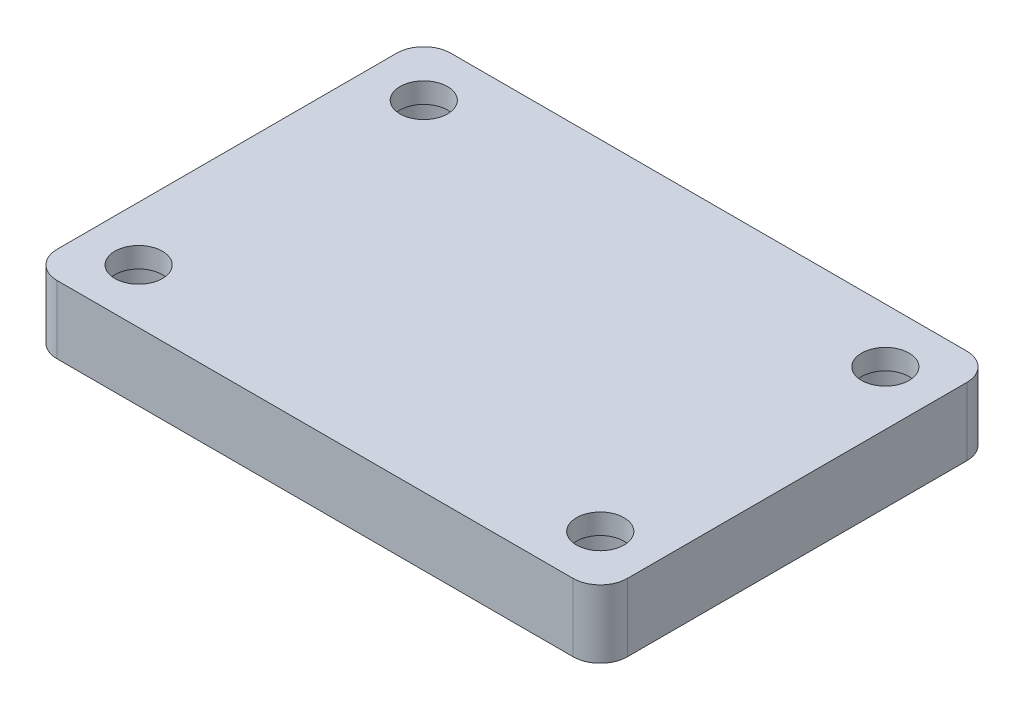
from build123d import *

# Parameters (mm, degrees)
SKETCH1_W                                     = 84
SKETCH1_H                                     = 58
EXTRUDE1_DEPTH                                = 10
CBORE_FOR_M6_HEX_SOCKET_HEAD_CAP1_D           = 7
CBORE_FOR_M6_HEX_SOCKET_HEAD_CAP1_CBORE_D     = 11
CBORE_FOR_M6_HEX_SOCKET_HEAD_CAP1_CBORE_DEPTH = 7
LPATTERN1_COUNT                               = 2
LPATTERN1_PITCH                               = 68
LPATTERN1_COUNT_DIR2                          = 2
LPATTERN1_PITCH_DIR2                          = 42
FILLET1_R                                     = 4


with BuildPart() as part:
    # Sketch1 → Extrude1 (new body)
    with BuildSketch(Plane(origin=(0, 0, 0), x_dir=(1, 0, 0), z_dir=(0, 1, 0))):
        with Locations((42, 29)):
            Rectangle(SKETCH1_W, SKETCH1_H)
    extrude(amount=EXTRUDE1_DEPTH)

    # CBORE for M6 Hex Socket Head Cap1 (through all)
    with Locations(Plane.XZ):
        with Locations((76, -50)):
            cbore_for_m6_hex_socket_head_cap1 = CounterBoreHole(CBORE_FOR_M6_HEX_SOCKET_HEAD_CAP1_D / 2, CBORE_FOR_M6_HEX_SOCKET_HEAD_CAP1_CBORE_D / 2, CBORE_FOR_M6_HEX_SOCKET_HEAD_CAP1_CBORE_DEPTH)

    # LPattern1: CBORE for M6 Hex Socket Head Cap1 2 × 2
    with Locations(*[(-i * LPATTERN1_PITCH, 0, j * LPATTERN1_PITCH_DIR2) for i in range(LPATTERN1_COUNT) for j in range(LPATTERN1_COUNT_DIR2) if (i, j) != (0, 0)]):
        add(cbore_for_m6_hex_socket_head_cap1, mode=Mode.SUBTRACT)

    # Fillet1
    fillet1_edges = [part.edges().sort_by_distance(p)[0] for p in [
        (0, 5, -58),
        (84, 5, -58),
        (84, 5, 0),
        (0, 5, 0),
    ]]
    fillet(fillet1_edges, radius=FILLET1_R)


solid = part.part
